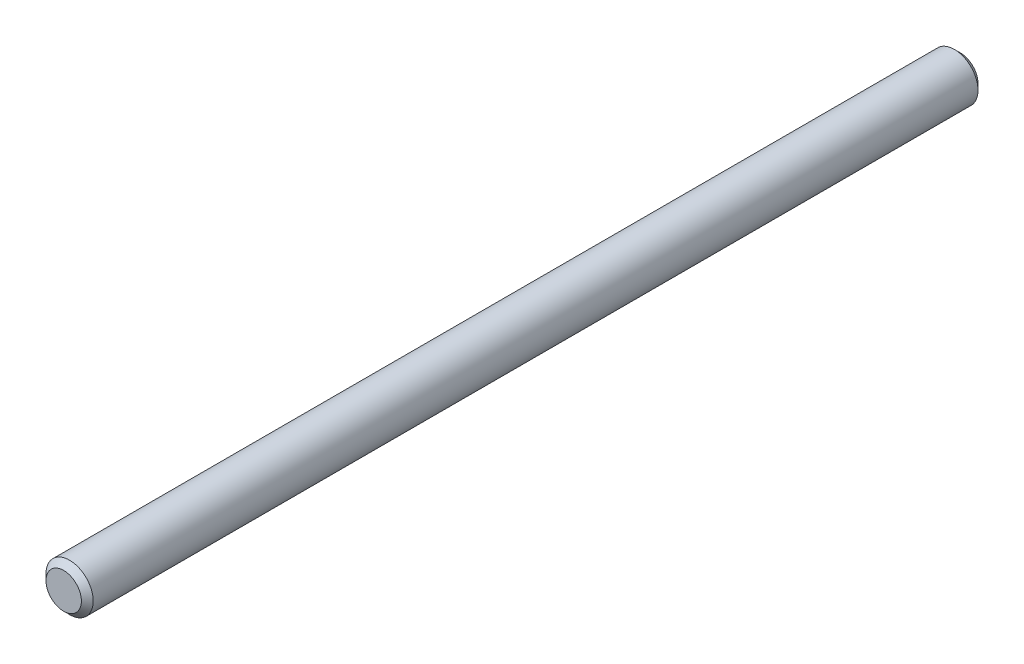
from build123d import *

# Parameters (mm, degrees)
SKETCH1_R           = 3
BOSS_EXTRUDE1_DEPTH = 114
CHAMFER1_SIZE       = 0.75
CHAMFER2_SIZE       = 0.75


with BuildPart() as part:
    # Sketch1 → Boss-Extrude1 (new body)
    with BuildSketch(Plane.XY):
        with Locations(Location((0, 0, 0), (0, 0, 180))):
            Circle(SKETCH1_R)
    extrude(amount=BOSS_EXTRUDE1_DEPTH)

    # Chamfer1
    chamfer1_edges = [part.edges().sort_by_distance(p)[0] for p in [
        (3, 0, 0),
    ]]
    chamfer(chamfer1_edges, length=CHAMFER1_SIZE)

    # Chamfer2
    chamfer2_edges = [part.edges().sort_by_distance(p)[0] for p in [
        (3, 0, 114),
    ]]
    chamfer(chamfer2_edges, length=CHAMFER2_SIZE)


solid = part.part
